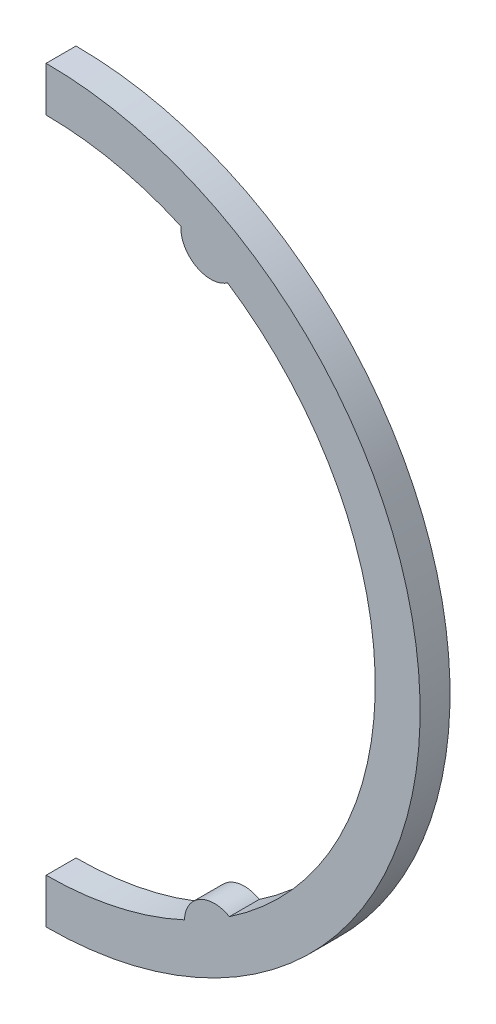
from build123d import *

# Parameters (mm, degrees)
SALIENTE_EXTRUIR2_DEPTH = 4


with BuildPart() as part:
    # Croquis1 → Saliente-Extruir2 (new body)
    with BuildSketch(Plane.XY):
        with BuildLine():
            Line((50, -100.385371697), (50, -94.385371697))
            ThreePointArc((50, -94.385371697), (59.472562128, -93.35362238), (68.500882915, -90.306761094))
            ThreePointArc((68.500882915, -90.306761094), (70.539255421, -86.910059757), (74.500570941, -86.932902716))
            ThreePointArc((74.500570941, -86.932902716), (93.999774318, -50.244446404), (74.265957135, -13.681648121))
            ThreePointArc((74.265957135, -13.681648121), (70.072325001, -13.890235332), (68.002756877, -10.23688798))
            ThreePointArc((68.002756877, -10.23688798), (59.205072417, -7.35902347), (50, -6.385371697))
            Line((50, -6.385371697), (50, -0.385371697))
            ThreePointArc((50, -0.385371697), (100, -50.385371697), (50, -100.385371697))
        make_face()
    extrude(amount=SALIENTE_EXTRUIR2_DEPTH)


solid = part.part
